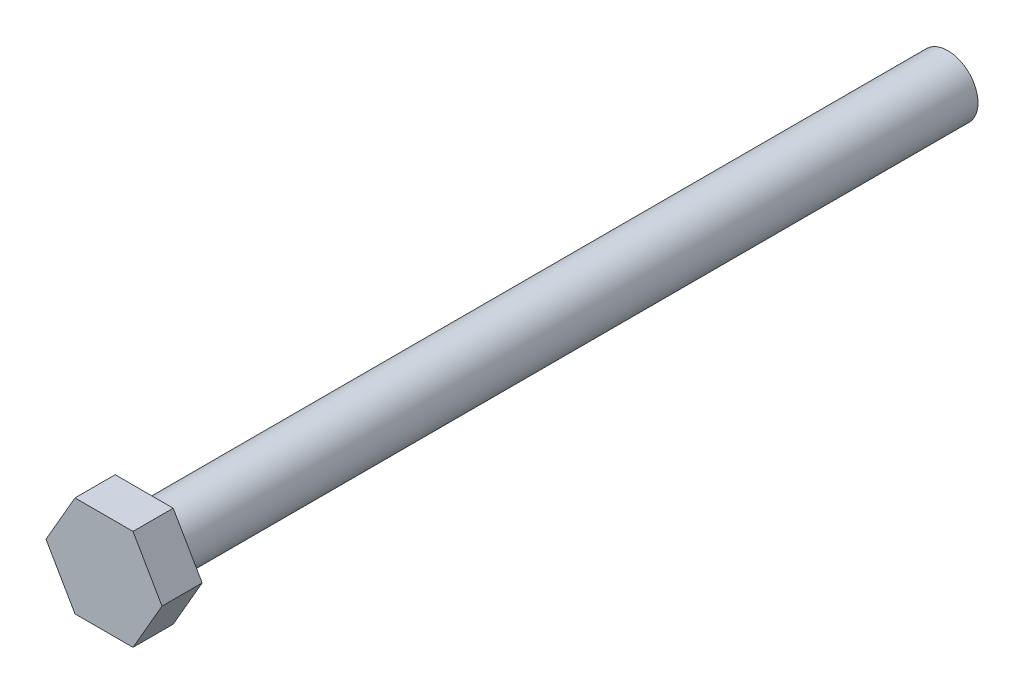
from build123d import *

# Parameters (mm, degrees)
SKETCH1_R      = 3
EXTRUDE1_DEPTH = 80
EXTRUDE2_DEPTH = 4


with BuildPart() as part:
    # Sketch1 → Extrude1 (new body)
    with BuildSketch(Plane.XY):
        Circle(SKETCH1_R)
    extrude(amount=-EXTRUDE1_DEPTH)

    # Sketch2 → Extrude2 (add)
    with BuildSketch(Plane.XY):
        Polygon((-2.886751346, 5), (-5.773502692, 0), (-2.886751346, -5), (2.886751346, -5), (5.773502692, 0), (2.886751346, 5), align=None)
    extrude(amount=EXTRUDE2_DEPTH)


solid = part.part
